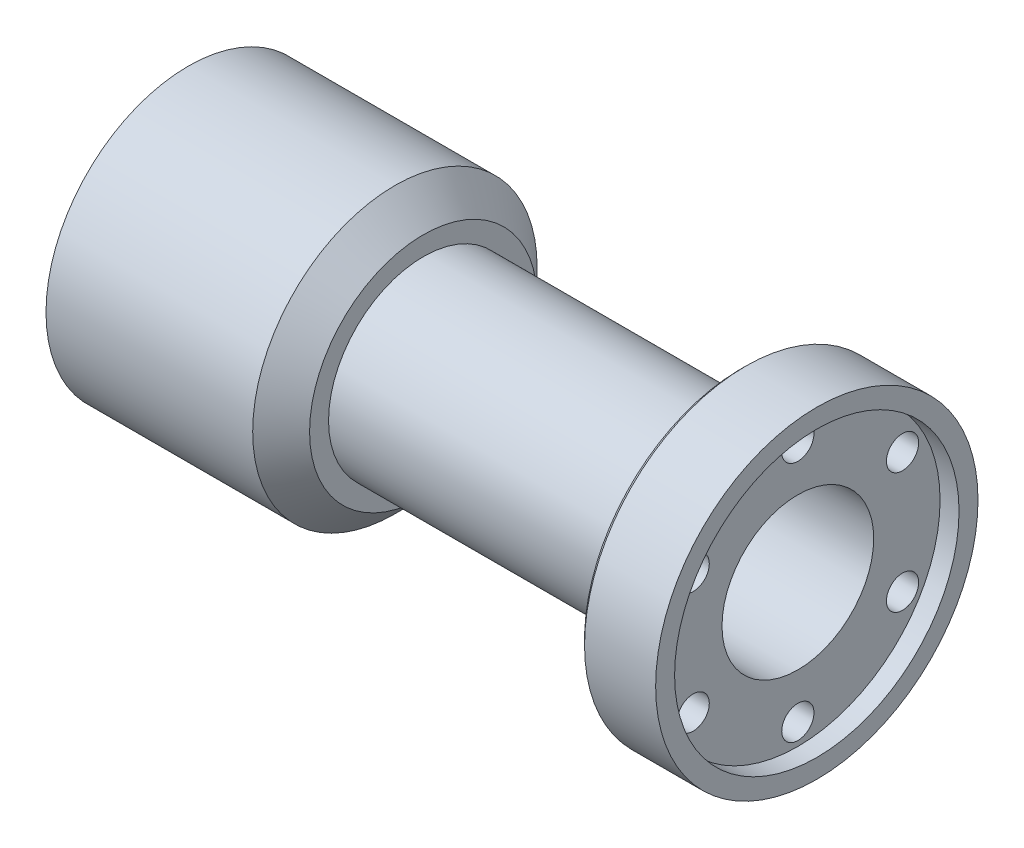
from build123d import *

# Parameters (mm, degrees)
SKETCH_2_R               = 8
CUT_EXTRUDE_1_DEPTH      = 71.524392943
SKETCH_6_R               = 3
PATTERN_CIRCULAR_2_COUNT = 6
SKETCH_5_R               = 15
CUT_EXTRUDE_2_DEPTH      = 2
CHAMFER_1_SIZE           = 3
CHAMFER_2_SIZE           = 0.5
PATTERN_CIRCULAR_3_COUNT = 8


with BuildPart() as part:
    # 草图1 → 旋转1 (revolve)
    with BuildSketch(Plane(origin=(0, 0, 0), x_dir=(1, 0, 0), z_dir=(0, 1, 0))):
        Polygon((0, 0), (0, 15), (24.8, 15), (24.8, 10), (58.3, 10), (58.3, 17), (66.3, 17), (66.3, 0), align=None)
    revolve(axis=Axis((-27.673469388, 0, 0), (1, 0, 0)))

    # 草图2 → 切除-拉伸1 (cut, through all)
    with BuildSketch(Plane.ZY):
        Circle(SKETCH_2_R)
    extrude(amount=-CUT_EXTRUDE_1_DEPTH, mode=Mode.SUBTRACT)

    # 草图3 → 打孔尺寸(%根据)内六角圆柱头螺钉的类型1 (revolve, cut)
    with BuildSketch(Plane(origin=(58.3, 12.75, 0), x_dir=(0, 0, 1), z_dir=(0, 1, 0))):
        Polygon((0, 0), (0, 8), (1.7, 8), (1.7, 3.4), (3, 3.4), (3, 0), align=None)
    hole_wizard_1 = revolve(axis=Axis((51.95, 12.75, 0), (1, 0, 0)), mode=Mode.SUBTRACT)

    # 切除-扫描1: sweep along a path in 草图7
    with BuildLine(Plane.XY) as sweep_1_path:
        ThreePointArc((58.3, 13.946689979), (47.696988858, 17.813586648), (42.072772548, 27.598520272))
    # 草图6 → 切除-扫描1 (sweep, cut)
    with BuildSketch(Plane.ZY.offset(-58.3)):
        with Locations((0, 12.75)):
            Circle(SKETCH_6_R)
    sweep_1 = sweep(path=sweep_1_path.line, mode=Mode.SUBTRACT)

    # 阵列(圆周)2: 打孔尺寸(%根据)内六角圆柱头螺钉的类型1, 切除-扫描1 ×6 about axis
    pattern_circular_2_axis = Axis((66.3, 0, 0), (-1, 0, 0))
    add([hole_wizard_1.rotate(pattern_circular_2_axis, i * 360 / PATTERN_CIRCULAR_2_COUNT) for i in range(1, PATTERN_CIRCULAR_2_COUNT)], mode=Mode.SUBTRACT)
    add([sweep_1.rotate(pattern_circular_2_axis, i * 360 / PATTERN_CIRCULAR_2_COUNT) for i in range(1, PATTERN_CIRCULAR_2_COUNT)], mode=Mode.SUBTRACT)

    # 草图5 → 切除-拉伸2 (cut)
    with BuildSketch(Plane(origin=(66.3, 0, 0), x_dir=(0, 0, -1), z_dir=(1, 0, 0))):
        Circle(SKETCH_5_R)
    extrude(amount=-CUT_EXTRUDE_2_DEPTH, mode=Mode.SUBTRACT)

    # 倒角1
    chamfer_1_edges = [part.edges().sort_by_distance(p)[0] for p in [
        (24.8, 0, 15),
    ]]
    chamfer(chamfer_1_edges, length=CHAMFER_1_SIZE)

    # 倒角2
    chamfer_2_edges = [part.edges().sort_by_distance(p)[0] for p in [
        (58.3, 0, 17),
    ]]
    chamfer(chamfer_2_edges, length=CHAMFER_2_SIZE)

    # 草图11 → M4 螺纹孔1 (revolve, cut)
    with BuildSketch(Plane.ZX.offset(11.25)):
        Polygon((0, 0), (0, 8.091420021), (1.65, 7.1), (1.65, 0), align=None)
    hole_wizard_m4_1 = revolve(axis=Axis((-6.35, 11.25, 0), (1, 0, 0)), mode=Mode.SUBTRACT)

    # 阵列(圆周)3: M4 螺纹孔1 ×8 about axis
    pattern_circular_3_axis = Axis((66.3, 0, 0), (-1, 0, 0))
    for i in range(1, PATTERN_CIRCULAR_3_COUNT):
        add(hole_wizard_m4_1.rotate(pattern_circular_3_axis, i * 360 / PATTERN_CIRCULAR_3_COUNT), mode=Mode.SUBTRACT)


solid = part.part
